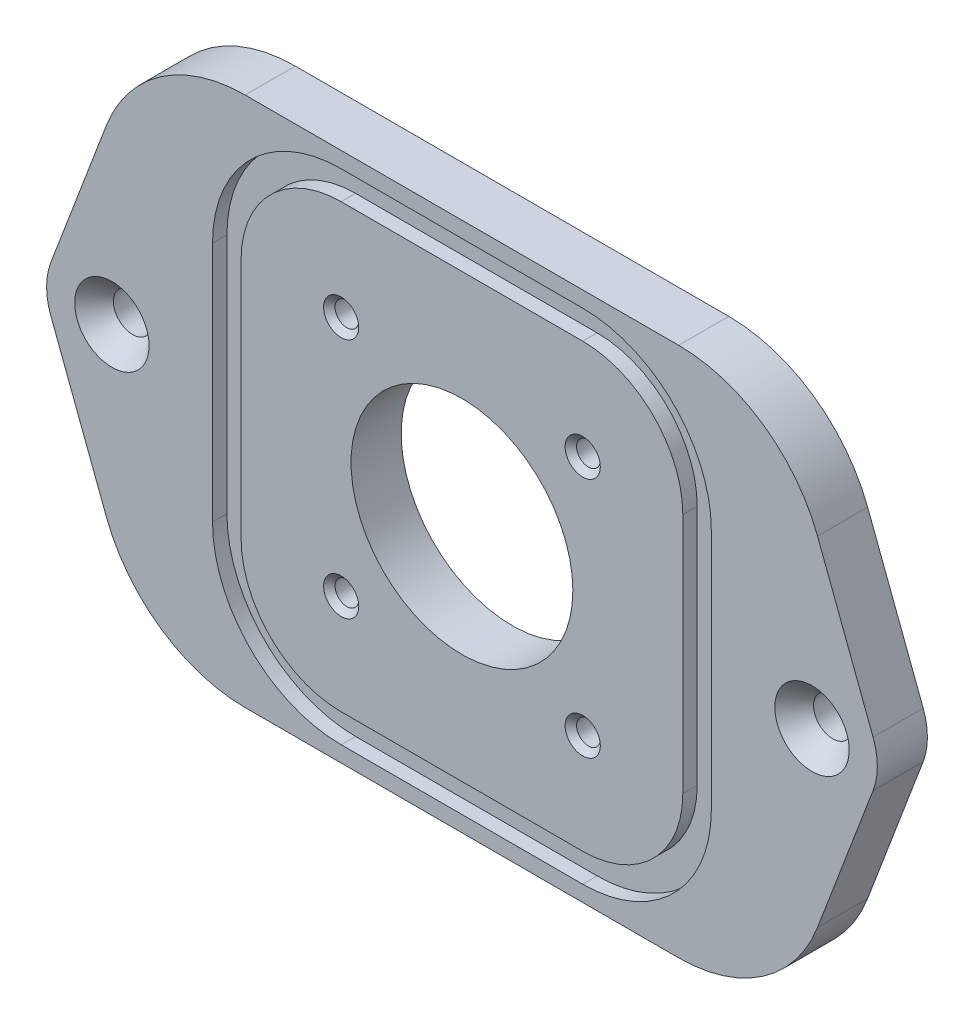
from build123d import *

# Parameters (mm, degrees)
SKETCH1_R                                      = 10.5664
BOSS_EXTRUDE1_DEPTH                            = 4.7752
CIRPATTERN1_COUNT                              = 4
CSK_FOR_6_FLAT_HEAD_MACHINE_SCREW1_D           = 3.6576
CSK_FOR_6_FLAT_HEAD_MACHINE_SCREW1_CSINK_D     = 7.0866
CSK_FOR_6_FLAT_HEAD_MACHINE_SCREW1_CSINK_ANGLE = 82
CUT_EXTRUDE1_DEPTH                             = 1.3716


with BuildPart() as part:
    # Sketch1 → Boss-Extrude1 (new body)
    with BuildSketch(Plane.XY):
        with BuildLine():
            Line((-20.6502, 25.273), (20.6502, 25.273))
            ThreePointArc((20.6502, 25.273), (28.685169884, 22.769919997), (33.876987837, 16.146387942))
            Line((33.876987837, 16.146387942), (39.16808693, 2.208601518))
            ThreePointArc((39.16808693, 2.208601518), (39.5732, 0), (39.16808693, -2.208601518))
            Line((39.16808693, -2.208601518), (33.876987837, -16.146387942))
            ThreePointArc((33.876987837, -16.146387942), (28.685169884, -22.769919997), (20.6502, -25.273))
            Line((20.6502, -25.273), (-20.6502, -25.273))
            ThreePointArc((-20.6502, -25.273), (-28.685169884, -22.769919997), (-33.876987837, -16.146387942))
            Line((-33.876987837, -16.146387942), (-39.16808693, -2.208601518))
            ThreePointArc((-39.16808693, -2.208601518), (-39.5732, 0), (-39.16808693, 2.208601518))
            Line((-39.16808693, 2.208601518), (-33.876987837, 16.146387942))
            ThreePointArc((-33.876987837, 16.146387942), (-28.685169884, 22.769919997), (-20.6502, 25.273))
        make_face()
        Circle(SKETCH1_R, mode=Mode.SUBTRACT)
    extrude(amount=-BOSS_EXTRUDE1_DEPTH)

    # Sketch2 → #4-40 Tapped Hole1 (revolve, cut)
    with BuildSketch(Plane(origin=(11.5062, 11.5062, 0), x_dir=(0, -1, 0), z_dir=(1, 0, 0))):
        Polygon((0, 0), (0, 4.7752), (1.6764, 4.7752), (1.1303, 4.2291), (1.1303, 0.5461), (1.6764, 0), align=None)
    f_4_40_tapped_hole1 = revolve(axis=Axis((11.5062, 11.5062, 6.35), (0, 0, -1)), mode=Mode.SUBTRACT)

    # CirPattern1: #4-40 Tapped Hole1 ×4 about axis
    cirpattern1_axis = Axis((0, 0, 0), (0, 0, 1))
    for i in range(1, CIRPATTERN1_COUNT):
        add(f_4_40_tapped_hole1.rotate(cirpattern1_axis, i * 360 / CIRPATTERN1_COUNT), mode=Mode.SUBTRACT)

    # CSK for #6 Flat Head Machine Screw1 (through all)
    with Locations(Plane.XY):
        with Locations((33.3502, 0), (-33.3502, 0)):
            CounterSinkHole(CSK_FOR_6_FLAT_HEAD_MACHINE_SCREW1_D / 2, CSK_FOR_6_FLAT_HEAD_MACHINE_SCREW1_CSINK_D / 2, counter_sink_angle=CSK_FOR_6_FLAT_HEAD_MACHINE_SCREW1_CSINK_ANGLE)

    # Sketch6 → Cut-Extrude1 (cut)
    with BuildSketch(Plane.XY):
        with BuildLine():
            Line((23.7617, 11.5062), (23.7617, -11.5062))
            ThreePointArc((23.7617, -11.5062), (20.172147157, -20.172147157), (11.5062, -23.7617))
            Line((11.5062, -23.7617), (-11.5062, -23.7617))
            ThreePointArc((-11.5062, -23.7617), (-20.172147157, -20.172147157), (-23.7617, -11.5062))
            Line((-23.7617, -11.5062), (-23.7617, 11.5062))
            ThreePointArc((-23.7617, 11.5062), (-20.172147157, 20.172147157), (-11.5062, 23.7617))
            Line((-11.5062, 23.7617), (11.5062, 23.7617))
            ThreePointArc((11.5062, 23.7617), (20.172147157, 20.172147157), (23.7617, 11.5062))
        make_face()
        with BuildLine():
            Line((21.0439, 11.5062), (21.0439, -11.5062))
            ThreePointArc((21.0439, -11.5062), (18.250372347, -18.250372347), (11.5062, -21.0439))
            Line((11.5062, -21.0439), (-11.5062, -21.0439))
            ThreePointArc((-11.5062, -21.0439), (-18.250372347, -18.250372347), (-21.0439, -11.5062))
            Line((-21.0439, -11.5062), (-21.0439, 11.5062))
            ThreePointArc((-21.0439, 11.5062), (-18.250372347, 18.250372347), (-11.5062, 21.0439))
            Line((-11.5062, 21.0439), (11.5062, 21.0439))
            ThreePointArc((11.5062, 21.0439), (18.250372347, 18.250372347), (21.0439, 11.5062))
        make_face(mode=Mode.SUBTRACT)
    extrude(amount=-CUT_EXTRUDE1_DEPTH, mode=Mode.SUBTRACT)


solid = part.part
